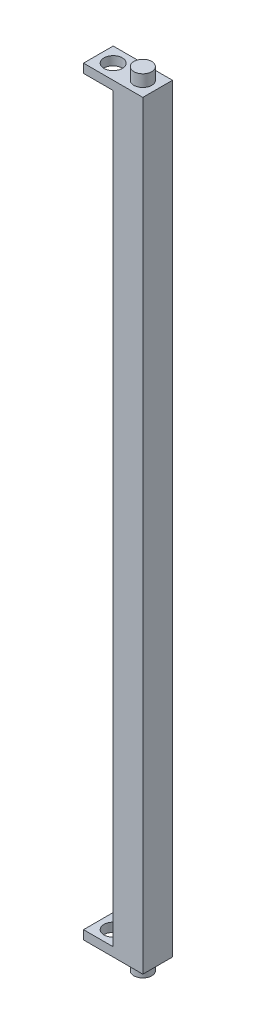
from build123d import *

# Parameters (mm, degrees)
SKETCH_2_W          = 10
SKETCH_2_H          = 5
EXTRUDE_1_DEPTH     = 1.5
SKETCH_3_R          = 1.55
CUT_EXTRUDE_1_DEPTH = 1.5
SKETCH_4_W          = 5
SKETCH_4_H          = 5
EXTRUDE_2_DEPTH     = 125
SKETCH_5_W          = 10
SKETCH_5_H          = 5
EXTRUDE_3_DEPTH     = 1.5
SKETCH_6_R          = 1.55
CUT_EXTRUDE_2_DEPTH = 1.5
SKETCH_7_R          = 1.5
EXTRUDE_4_DEPTH     = 2
EXTRUDE_START       = 2
SKETCH_8_R          = 1.5
EXTRUDE_5_DEPTH     = 2


with BuildPart() as part:
    # 草图2 → 凸台-拉伸1 (new body)
    with BuildSketch(Plane(origin=(0, 0, 0), x_dir=(1, 0, 0), z_dir=(0, 1, 0))):
        Rectangle(SKETCH_2_W, SKETCH_2_H)
    extrude(amount=EXTRUDE_1_DEPTH)

    # 草图3 → 切除-拉伸1 (cut)
    with BuildSketch(Plane.XZ):
        with Locations(Location((-2.5, 0, 0), (0, 0, 270))):
            Circle(SKETCH_3_R)
    extrude(amount=-CUT_EXTRUDE_1_DEPTH, mode=Mode.SUBTRACT)

    # 草图4 → 凸台-拉伸2 (add)
    with BuildSketch(Plane.XZ):
        with Locations((2.5, 0)):
            Rectangle(SKETCH_4_W, SKETCH_4_H)
    extrude(amount=EXTRUDE_2_DEPTH)

    # 草图5 → 凸台-拉伸3 (add)
    with BuildSketch(Plane.XZ.offset(125)):
        Rectangle(SKETCH_5_W, SKETCH_5_H)
    extrude(amount=EXTRUDE_3_DEPTH)

    # 草图6 → 切除-拉伸2 (cut)
    with BuildSketch(Plane.XZ.offset(126.5)):
        with Locations(Location((-2.5, 0, 0), (0, 0, 270))):
            Circle(SKETCH_6_R)
    extrude(amount=-CUT_EXTRUDE_2_DEPTH, mode=Mode.SUBTRACT)

    # 草图7 → 凸台-拉伸4 (add)
    with BuildSketch(Plane(origin=(0, 1.5, 0), x_dir=(1, 0, 0), z_dir=(0, 1, 0))):
        with Locations(Location((2.5, 0, 0), (0, 0, 270))):
            Circle(SKETCH_7_R)
    extrude(amount=EXTRUDE_4_DEPTH)

    # 草图8 → 凸台-拉伸5 (add)
    with BuildSketch(Plane.XZ.offset(126.5).offset(EXTRUDE_START)):
        with Locations(Location((2.5, 0, 0), (0, 0, 90))):
            Circle(SKETCH_8_R)
    extrude(amount=-EXTRUDE_5_DEPTH)


solid = part.part
